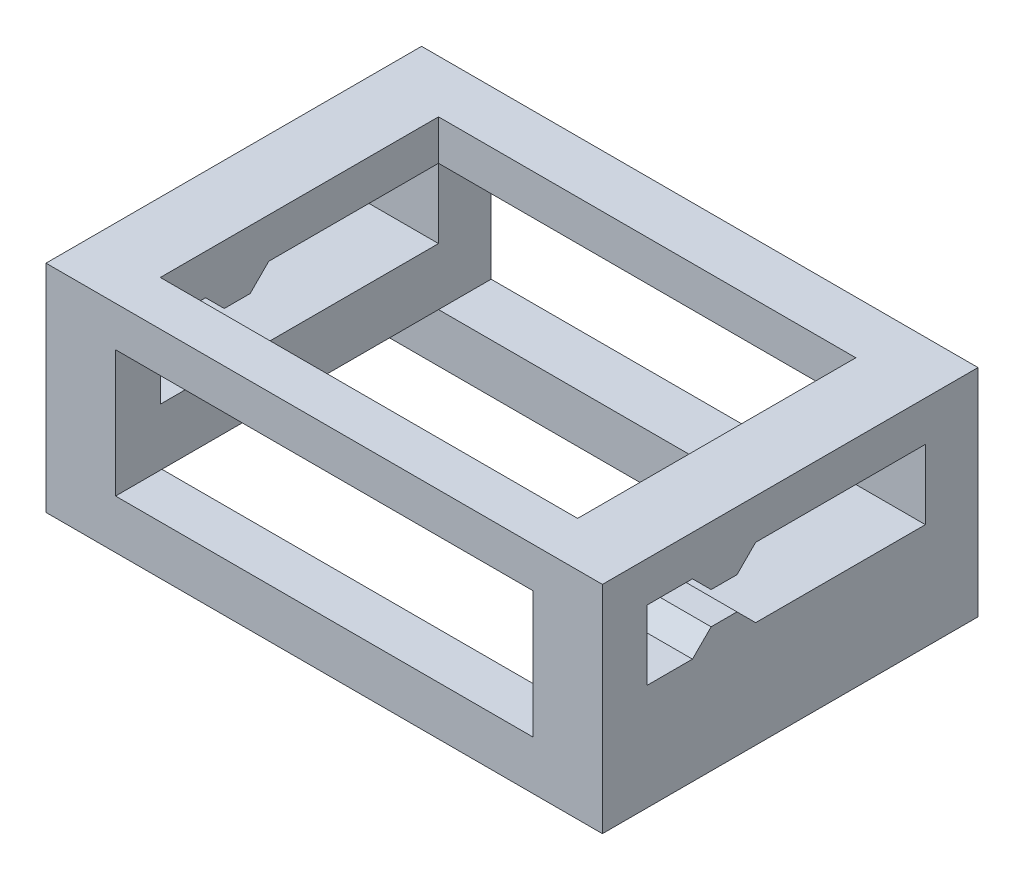
from build123d import *

# Parameters (mm, degrees)
SKETCH5_R           = 3
SKETCH5_W           = 20
SKETCH5_H           = 5
SKETCH5_W_2         = 12.659523363
SKETCH5_H_2         = 7.033068536
BOSS_EXTRUDE1_DEPTH = 5
SKETCH6_W           = 330
SKETCH6_H           = 15
BOSS_EXTRUDE2_DEPTH = 5
SKETCH8_R           = 2
SKETCH8_R_2         = 3.1
CUT_EXTRUDE1_DEPTH  = 5
SKETCH9_W           = 27
SKETCH9_H           = 12
BOSS_EXTRUDE3_DEPTH = 5
SKETCH10_W          = 3.217546145
SKETCH10_H          = 2.890079535
SKETCH10_W_2        = 3.782453855
SKETCH10_H_2        = 3.521306538
SKETCH10_W_3        = 3.332881198
BOSS_EXTRUDE4_DEPTH = 30
BOSS_EXTRUDE6_DEPTH = 5
CUT_EXTRUDE4_DEPTH  = 14.3
SKETCH15_W          = 3.332881198
SKETCH15_H          = 3.521306538
SKETCH15_W_2        = 3.782453855
BOSS_EXTRUDE9_DEPTH = 14.3


with BuildPart() as part:
    # Sketch5 → Boss-Extrude1 (new body)
    with BuildSketch(Plane(origin=(0, 0, 0), x_dir=(0, 0, -1), z_dir=(1, 0, 0))):
        with BuildLine():
            Line((-40, -10), (0, -10))
            Line((0, -10), (0, 0))
            Line((0, 0), (0, 10))
            Line((0, 10), (5, 10))
            Line((5, 10), (5, 0))
            Line((5, 0), (5, -10))
            Line((5, -10), (245, -10))
            Line((245, -10), (245, 0))
            Line((245, 0), (245, 10))
            Line((245, 10), (250, 10))
            Line((250, 10), (250, 0))
            Line((250, 0), (250, -10))
            Line((250, -10), (290, -10))
            Line((290, -10), (290, 50))
            Line((290, 50), (-7.797224701, 50))
            Line((-7.797224701, 50), (-7.797224701, 69.428123594))
            ThreePointArc((-7.797224701, 69.428123594), (-10.726156889, 76.499191405), (-17.797224701, 79.428123594))
            Line((-17.797224701, 79.428123594), (-30, 79.428123594))
            ThreePointArc((-30, 79.428123594), (-37.071067812, 76.499191405), (-40, 69.428123594))
            Line((-40, 69.428123594), (-40, 50))
            Line((-40, 50), (-40, -10))
        make_face()
        with Locations((-25, 35)):
            Circle(SKETCH5_R, mode=Mode.SUBTRACT)
        with Locations((275, 35)):
            Circle(SKETCH5_R, mode=Mode.SUBTRACT)
        with Locations((89.606343961, 41.844097949)):
            Rectangle(SKETCH5_W, SKETCH5_H, mode=Mode.SUBTRACT)
        with Locations((14.606343961, 41.844097949)):
            Rectangle(SKETCH5_W, SKETCH5_H, mode=Mode.SUBTRACT)
        with Locations((-23.96746302, 63.333382994)):
            Rectangle(SKETCH5_W_2, SKETCH5_H_2, mode=Mode.SUBTRACT)
        with Locations((164.606343961, 41.844097949)):
            Rectangle(SKETCH5_W, SKETCH5_H, mode=Mode.SUBTRACT)
        with Locations((239.606343961, 41.844097949)):
            Rectangle(SKETCH5_W, SKETCH5_H, mode=Mode.SUBTRACT)
    extrude(amount=BOSS_EXTRUDE1_DEPTH)

    # Sketch6 → Boss-Extrude2 (add)
    with BuildSketch(Plane(origin=(5, 0, 0), x_dir=(0, 0, -1), z_dir=(1, 0, 0))):
        with Locations((125, -17.5)):
            Rectangle(SKETCH6_W, SKETCH6_H)
    extrude(amount=-BOSS_EXTRUDE2_DEPTH)

    # Sketch8 → Cut-Extrude1 (cut)
    with BuildSketch(Plane(origin=(5, 0, 0), x_dir=(0, 0, -1), z_dir=(1, 0, 0))):
        with Locations((30.968640194, 16)):
            Circle(SKETCH8_R)
        with Locations((30.968640194, -20)):
            Circle(SKETCH8_R)
        with Locations(Location((66.968640194, -20, 0), (0, 0, 180))):
            Circle(SKETCH8_R)
        with Locations(Location((66.968640194, 16, 0), (0, 0, 180))):
            Circle(SKETCH8_R)
        with Locations((48.968640194, -2)):
            Circle(SKETCH8_R_2)
    extrude(amount=-CUT_EXTRUDE1_DEPTH, mode=Mode.SUBTRACT)

    # Sketch9 → Boss-Extrude3 (add)
    with BuildSketch(Plane(origin=(5, 0, 0), x_dir=(0, 0, -1), z_dir=(1, 0, 0))):
        with Locations((128.106343961, 56)):
            Rectangle(SKETCH9_W, SKETCH9_H)
        Polygon((121.079302135, 59.109920465), (122.421377926, 57.767844673), (124.280039233, 57.767844673), (125.622115024, 59.109920465), (137.823890106, 59.109920465), (137.823890106, 54.109920465), (125.622115024, 54.109920465), (124.280039233, 55.451996257), (122.421377926, 55.451996257), (121.079302135, 54.109920465), (117.823890106, 54.109920465), (117.823890106, 59.109920465), align=None, mode=Mode.SUBTRACT)
    extrude(amount=-BOSS_EXTRUDE3_DEPTH)

    # Sketch10 → Boss-Extrude4 (add)
    with BuildSketch(Plane(origin=(5, 0, 0), x_dir=(0, 0, -1), z_dir=(1, 0, 0))):
        with Locations((116.215117034, 60.554960233)):
            Rectangle(SKETCH10_W, SKETCH10_H)
        with Locations((139.715117034, 60.554960233)):
            Rectangle(SKETCH10_W_2, SKETCH10_H)
        with Locations((139.715117034, 48.239346731)):
            Rectangle(SKETCH10_W_2, SKETCH10_H_2)
        with Locations((116.27278456, 48.239346731)):
            Rectangle(SKETCH10_W_3, SKETCH10_H_2)
    extrude(amount=BOSS_EXTRUDE4_DEPTH)

    # Sketch13 → Boss-Extrude6 (add)
    with BuildSketch(Plane(origin=(35, 0, 0), x_dir=(0, 0, -1), z_dir=(1, 0, 0))):
        Polygon((114.606343961, 46.478693462), (141.606343961, 46.478693462), (141.606343961, 62), (117.823890106, 62), (114.606343961, 62), align=None)
        Polygon((117.823890106, 54.109920465), (121.079302135, 54.109920465), (122.421377926, 55.451996257), (124.280039233, 55.451996257), (125.622115024, 54.109920465), (137.823890106, 54.109920465), (137.823890106, 59.109920465), (125.622115024, 59.109920465), (124.280039233, 57.767844673), (122.421377926, 57.767844673), (121.079302135, 59.109920465), (117.823890106, 59.109920465), align=None, mode=Mode.SUBTRACT)
    extrude(amount=BOSS_EXTRUDE6_DEPTH)

    # Sketch14 → Cut-Extrude4 (cut)
    with BuildSketch(Plane.ZY):
        with BuildLine():
            Line((-141.606343961, 50), (-114.606343961, 50))
            Line((-114.606343961, 50), (7.797224701, 50))
            Line((7.797224701, 50), (7.797224701, 69.428123594))
            ThreePointArc((7.797224701, 69.428123594), (10.726156889, 76.499191405), (17.797224701, 79.428123594))
            Line((17.797224701, 79.428123594), (30, 79.428123594))
            ThreePointArc((30, 79.428123594), (37.071067812, 76.499191405), (40, 69.428123594))
            Line((40, 69.428123594), (40, -25))
            Line((40, -25), (-290, -25))
            Line((-290, -25), (-290, 50))
            Line((-290, 50), (-141.606343961, 50))
        make_face()
    extrude(amount=-CUT_EXTRUDE4_DEPTH, mode=Mode.SUBTRACT)

    # Sketch15 → Boss-Extrude9 (add)
    with BuildSketch(Plane.ZY.offset(-14.3)):
        with Locations((-116.27278456, 48.239346731)):
            Rectangle(SKETCH15_W, SKETCH15_H)
        with Locations((-139.715117034, 48.239346731)):
            Rectangle(SKETCH15_W_2, SKETCH15_H)
    extrude(amount=BOSS_EXTRUDE9_DEPTH)


solid = part.part
